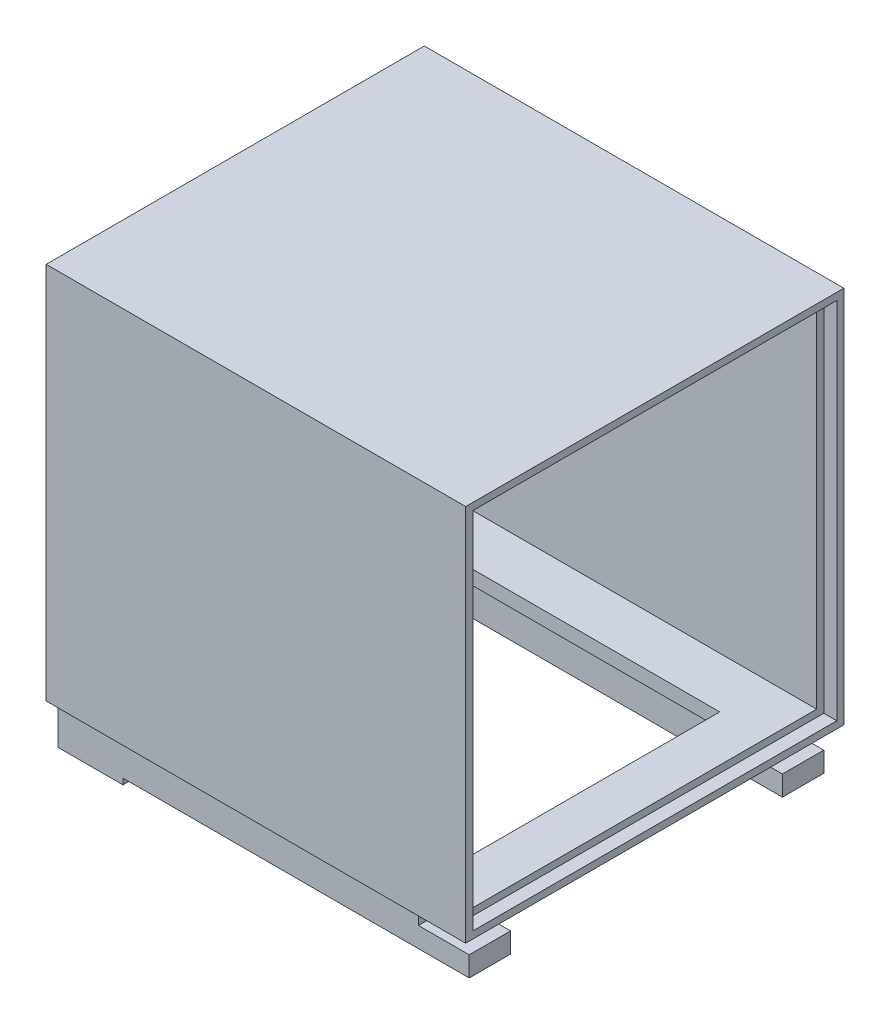
from build123d import *

# Parameters (mm, degrees)
SKETCH1_W            = 355
SKETCH1_H            = 320
BOSS_EXTRUDE1_DEPTH  = 320
SKETCH9_W            = 296
SKETCH9_H            = 296
CUT_EXTRUDE3_DEPTH   = 345
SKETCH10_W           = 308
SKETCH10_H           = 308
CUT_EXTRUDE4_DEPTH   = 11
SKETCH11_W           = 280
SKETCH11_H           = 210
CUT_EXTRUDE5_DEPTH   = 20
SKETCH12_W           = 285
SKETCH12_H           = 35
BOSS_EXTRUDE4_DEPTH  = 17
SKETCH14_W           = 285
SKETCH14_H           = 35
BOSS_EXTRUDE5_DEPTH  = 17
SKETCH15_W           = 328
SKETCH15_H           = 35
BOSS_EXTRUDE6_DEPTH  = 17
SKETCH16_W           = 35
SKETCH16_H           = 300
BOSS_EXTRUDE7_DEPTH  = 5
SKETCH18_W           = 20
SKETCH18_H           = 300
BOSS_EXTRUDE10_DEPTH = 39


with BuildPart() as part:
    # Sketch1 → Boss-Extrude1 (new body)
    with BuildSketch(Plane(origin=(0, 0, 0), x_dir=(1, 0, 0), z_dir=(0, 1, 0))):
        with Locations((177.5, 160)):
            Rectangle(SKETCH1_W, SKETCH1_H)
    extrude(amount=BOSS_EXTRUDE1_DEPTH)

    # Sketch9 → Cut-Extrude3 (cut)
    with BuildSketch(Plane(origin=(355, 0, 0), x_dir=(0, 0, -1), z_dir=(1, 0, 0))):
        with Locations((160, 160)):
            Rectangle(SKETCH9_W, SKETCH9_H)
    extrude(amount=-CUT_EXTRUDE3_DEPTH, mode=Mode.SUBTRACT)

    # Sketch10 → Cut-Extrude4 (cut)
    with BuildSketch(Plane(origin=(355, 0, 0), x_dir=(0, 0, -1), z_dir=(1, 0, 0))):
        with Locations((160, 160)):
            Rectangle(SKETCH10_W, SKETCH10_H)
    extrude(amount=-CUT_EXTRUDE4_DEPTH, mode=Mode.SUBTRACT)

    # Sketch11 → Cut-Extrude5 (cut)
    with BuildSketch(Plane.XZ):
        with Locations((165, -160)):
            Rectangle(SKETCH11_W, SKETCH11_H)
    extrude(amount=-CUT_EXTRUDE5_DEPTH, mode=Mode.SUBTRACT)

    # Sketch12 → Boss-Extrude4 (add)
    with BuildSketch(Plane.XZ):
        with Locations((162.5, -27.5)):
            Rectangle(SKETCH12_W, SKETCH12_H)
    extrude(amount=BOSS_EXTRUDE4_DEPTH)

    # Sketch14 → Boss-Extrude5 (add)
    with BuildSketch(Plane.XZ):
        with Locations((162.5, -292.5)):
            Rectangle(SKETCH14_W, SKETCH14_H)
    extrude(amount=BOSS_EXTRUDE5_DEPTH)

    # Sketch15 → Boss-Extrude6 (add)
    with BuildSketch(Plane.XZ.offset(17)):
        with Locations((184, -27.5)):
            Rectangle(SKETCH15_W, SKETCH15_H)
        with Locations((184, -292.5)):
            Rectangle(SKETCH15_W, SKETCH15_H)
    extrude(amount=BOSS_EXTRUDE6_DEPTH)

    # Sketch16 → Boss-Extrude7 (add)
    with BuildSketch(Plane.XZ.offset(34)):
        with Locations((37.5, -160)):
            Rectangle(SKETCH16_W, SKETCH16_H)
    extrude(amount=BOSS_EXTRUDE7_DEPTH)

    # Sketch18 → Boss-Extrude10 (add)
    with BuildSketch(Plane.XZ):
        with Locations((10, -160)):
            Rectangle(SKETCH18_W, SKETCH18_H)
    extrude(amount=BOSS_EXTRUDE10_DEPTH)


solid = part.part
